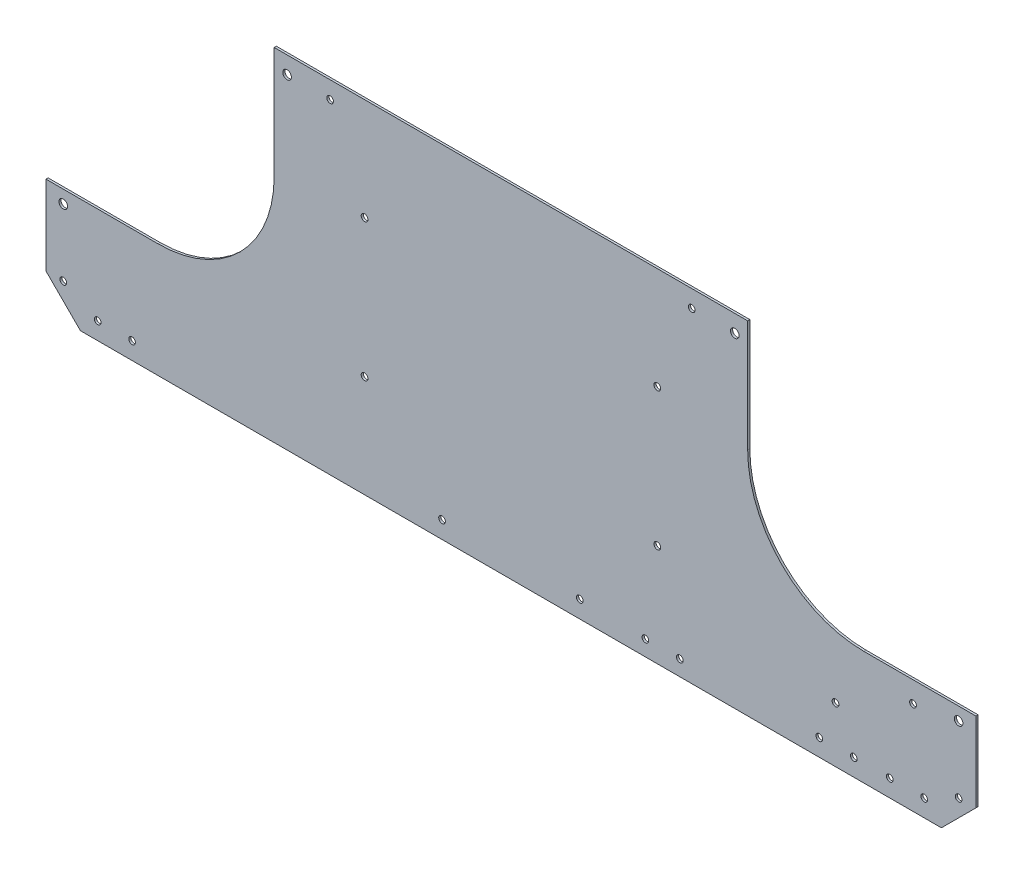
from build123d import *

# Parameters (mm, degrees)
SKETCH3_W                    = 914.4
SKETCH3_H                    = 609.6
BOSS_EXTRUDE1_DEPTH          = 0.79375
SKETCH4_OUTSIDE_W            = 1136.194
SKETCH4_OUTSIDE_H            = 831.394
CUT_EXTRUDE1_DEPTH           = 2.54
CUT_EXTRUDE2_DEPTH           = 2.54
CUT_EXTRUDE3_DEPTH           = 2.54
F_10_0_1935_DIAMETER_HOLE1_D = 4.9149
F_1_4_0_25_DIAMETER_HOLE1_D  = 6.35
F_10_CLEARANCE_HOLE1_D       = 4.9784


with BuildPart() as part:
    # Sketch3 → Boss-Extrude1 (new, symmetric)
    with BuildSketch(Plane.XY):
        Rectangle(SKETCH3_W, SKETCH3_H)
    extrude(amount=BOSS_EXTRUDE1_DEPTH, both=True)

    # Sketch4 outside → Cut-Extrude1 (cut)
    with BuildSketch(Plane.XY.offset(0.79375)):
        Rectangle(SKETCH4_OUTSIDE_W, SKETCH4_OUTSIDE_H)
        with BuildLine():
            Line((-326.734938229, -279.58151343), (-352.134938229, -254.18151343))
            Line((-352.134938229, -254.18151343), (-352.134938229, -29.709012922))
            ThreePointArc((-352.134938229, -29.709012922), (-351.390989453, -27.912961698), (-349.594938229, -27.169012922))
            Line((-349.594938229, -27.169012922), (331.125061771, -27.169012922))
            ThreePointArc((331.125061771, -27.169012922), (332.921112995, -27.912961698), (333.665061771, -29.709012922))
            Line((333.665061771, -29.709012922), (333.665061771, -254.18151343))
            Line((333.665061771, -254.18151343), (308.265061771, -279.58151343))
            Line((308.265061771, -279.58151343), (-326.734938229, -279.58151343))
        make_face(mode=Mode.SUBTRACT)
    extrude(amount=-CUT_EXTRUDE1_DEPTH, mode=Mode.SUBTRACT)

    # Sketch7 → Cut-Extrude2 (cut)
    with BuildSketch(Plane.XY.offset(0.79375)):
        with BuildLine():
            Line((-269.584938229, -195.44401343), (-374.359938229, -195.44401343))
            Line((-374.359938229, -195.44401343), (-374.359938229, -4.94401343))
            Line((-374.359938229, -4.94401343), (-183.859938229, -4.94401343))
            Line((-183.859938229, -4.94401343), (-183.859938229, -109.71901343))
            ThreePointArc((-183.859938229, -109.71901343), (-208.968209412, -170.335742247), (-269.584938229, -195.44401343))
        make_face()
    extrude(amount=-CUT_EXTRUDE2_DEPTH, mode=Mode.SUBTRACT)

    # Sketch8 → Cut-Extrude3 (cut)
    with BuildSketch(Plane.XY.offset(0.79375)):
        with BuildLine():
            Line((251.115061771, -195.44401343), (355.890061771, -195.44401343))
            Line((355.890061771, -195.44401343), (355.890061771, -4.94401343))
            Line((355.890061771, -4.94401343), (165.390061771, -4.94401343))
            Line((165.390061771, -4.94401343), (165.390061771, -109.71901343))
            ThreePointArc((165.390061771, -109.71901343), (190.498332954, -170.335742247), (251.115061771, -195.44401343))
        make_face()
    extrude(amount=-CUT_EXTRUDE3_DEPTH, mode=Mode.SUBTRACT)

    # #10 (0.1935) Diameter Hole1 (through all)
    with Locations(Plane.XY.offset(0.79375)):
        with Locations((-288.634938229, -266.88151343), (-314.034938229, -266.88151343), (-339.434938229, -254.18151343), (89.952061771, -268.113109138), (115.352061771, -268.113109138), (218.222061771, -266.881513934), (243.622061771, -266.881513934), (295.565061771, -266.88151343), (270.165061771, -266.88151343), (320.965061771, -254.18151343), (124.115061771, -39.86901343), (-142.584938737, -39.86901343), (-60.034938737, -266.88151343), (41.565061263, -266.88151343)):
            Hole(F_10_0_1935_DIAMETER_HOLE1_D / 2)

    # 1/4 (0.25) Diameter Hole1 (through all)
    with Locations(Plane.XY.offset(0.79375)):
        with Locations((-339.434938229, -204.969013938), (320.965061771, -204.96901343), (155.865061771, -39.86901343), (-174.334938229, -39.86901343)):
            Hole(F_1_4_0_25_DIAMETER_HOLE1_D / 2)

    # #10 Clearance Hole1 (through all)
    with Locations(Plane.XY.offset(0.79375)):
        with Locations((-117.184938229, -204.17526343), (-117.184938229, -102.57526343), (98.715061771, -102.57526343), (98.715061771, -204.17526343), (230.160061773, -238.782763436), (287.31006177, -210.842763429)):
            Hole(F_10_CLEARANCE_HOLE1_D / 2)


solid = part.part
